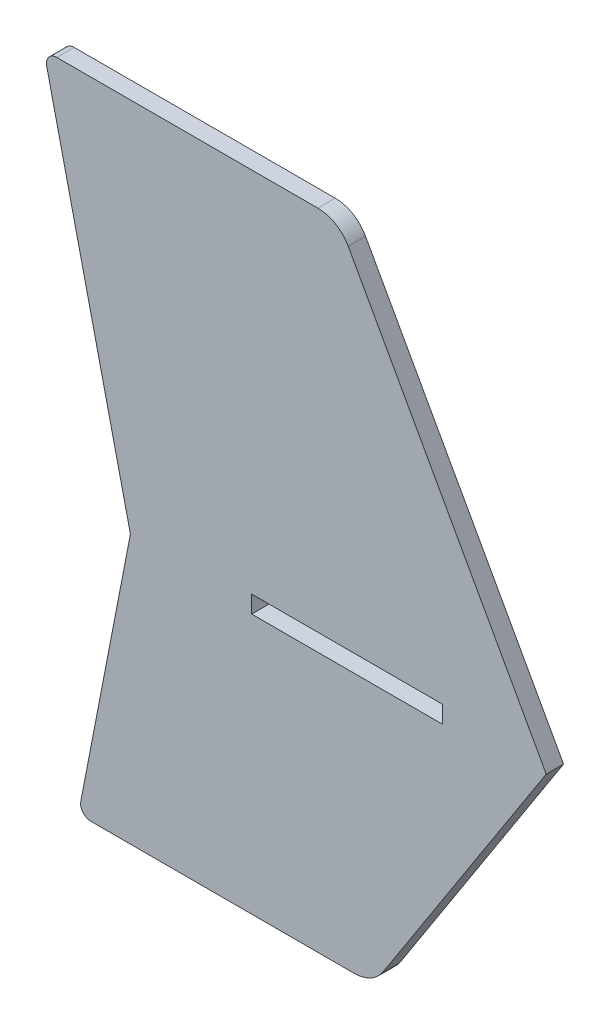
from build123d import *

# Parameters (mm, degrees)
GRUNDPLATTE_DEPTH      = 5
SKIZZE2_W              = 55
SKIZZE2_H              = 5
NUTH_HENLEITWERK_DEPTH = 15
VERRUNDUNG1_R          = 10
VERRUNDUNG2_R          = 3


with BuildPart() as part:
    # Skizze1 → Grundplatte (new body)
    with BuildSketch(Plane.XY):
        Polygon((-50, 186), (35, 186), (95, 77.5), (45, 0), (0, 0), (-40, 0), (-25, 77.5), align=None)
    extrude(amount=GRUNDPLATTE_DEPTH)

    # Skizze2 → NutHöhenleitwerk (cut)
    with BuildSketch(Plane.XY.offset(5)):
        with Locations((37.5, 77.5)):
            Rectangle(SKIZZE2_W, SKIZZE2_H)
    extrude(amount=-NUTH_HENLEITWERK_DEPTH, mode=Mode.SUBTRACT)

    # Verrundung1
    verrundung1_edges = [part.edges().sort_by_distance(p)[0] for p in [
        (35, 186, 2.5),
        (45, 0, 2.5),
    ]]
    fillet(verrundung1_edges, radius=VERRUNDUNG1_R)

    # Verrundung2
    verrundung2_edges = [part.edges().sort_by_distance(p)[0] for p in [
        (-50, 186, 2.5),
        (-40, 0, 2.5),
    ]]
    fillet(verrundung2_edges, radius=VERRUNDUNG2_R)


solid = part.part
